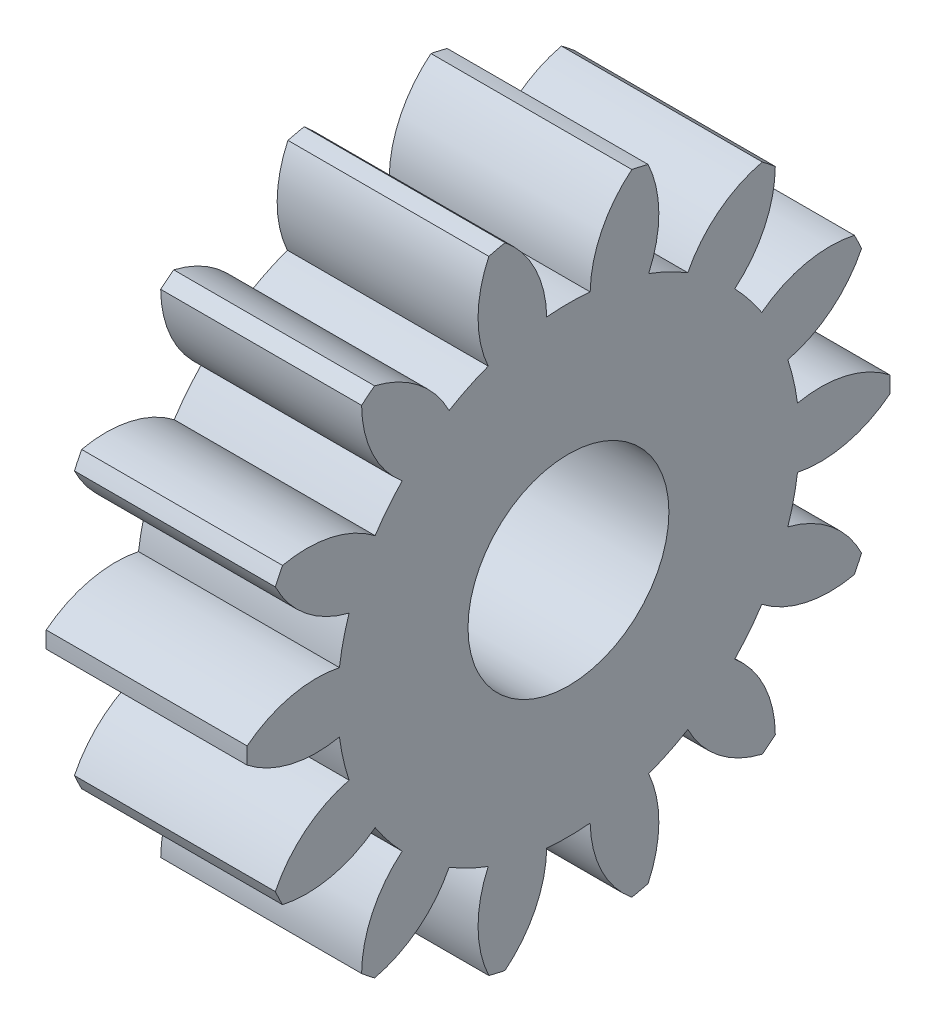
from build123d import *

# Parameters (mm, degrees)
BASPROSKE_W     = 5
BASPROSKE_H     = 8
TOOTHCUT_DEPTH  = 13.369316877
TEETHCUTS_COUNT = 14
TEETHCUTS_ANGLE = 334.285714286
BORSKE_R        = 2.5
BORE_DEPTH      = 50.0000508


with BuildPart() as part:
    # BasProSke → Base-Revolve (revolve)
    with BuildSketch(Plane(origin=(0, 0, 0), x_dir=(1, 0, 0), z_dir=(0, 1, 0)), mode=Mode.PRIVATE) as base_revolve_sk:
        with Locations((2.5, 4)):
            Rectangle(BASPROSKE_W, BASPROSKE_H)
    revolve(base_revolve_sk.sketch.rotate(Axis((-10, 0, 0), (1, 0, 0)), 180), axis=Axis((-10, 0, 0), (1, 0, 0)))

    # TooCutSke → ToothCut (cut, through all)
    with BuildSketch(Plane(origin=(0, 0, 0), x_dir=(0, 0, -1), z_dir=(1, 0, 0))):
        with BuildLine():
            ThreePointArc((0.540393256, 5.723545765), (0, 5.749), (-0.540393256, 5.723545765))
            ThreePointArc((-0.540393256, 5.723545765), (-0.832220085, 6.912663993), (-1.603550271, 7.863566092))
            ThreePointArc((-1.603550271, 7.863566092), (0, 8.0254), (1.603550271, 7.863566092))
            ThreePointArc((1.603550271, 7.863566092), (0.832220085, 6.912663993), (0.540393256, 5.723545765))
        make_face()
    toothcut = extrude(amount=TOOTHCUT_DEPTH, mode=Mode.SUBTRACT)

    # TeethCuts: ToothCut ×14 about axis
    teethcuts_axis = Axis((-10, 0, 0), (1, 0, 0))
    for i in range(1, TEETHCUTS_COUNT):
        add(toothcut.rotate(teethcuts_axis, i * TEETHCUTS_ANGLE / (TEETHCUTS_COUNT - 1)), mode=Mode.SUBTRACT)

    # BorSke → Bore (cut, symmetric)
    with BuildSketch(Plane(origin=(0, 0, 0), x_dir=(0, 0, -1), z_dir=(1, 0, 0))):
        with Locations(Location((0, 0, 0), (0, 0, 180))):
            Circle(BORSKE_R)
    extrude(amount=BORE_DEPTH, both=True, mode=Mode.SUBTRACT)


solid = part.part
